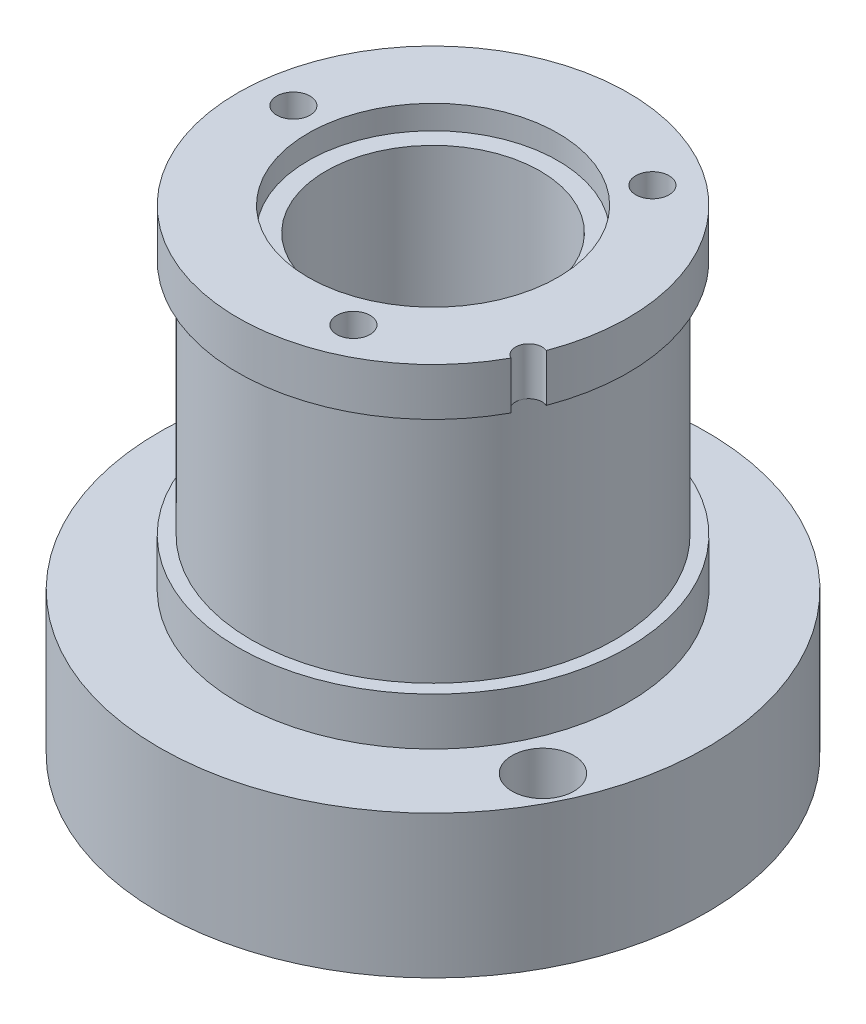
from build123d import *

# Parameters (mm, degrees)
SKETCH1_R                     = 14.605
BOSS_EXTRUDE2_DEPTH           = 25.4
SKETCH10_R                    = 5.715
CUT_EXTRUDE5_DEPTH            = 48.424233935
SKETCH11_R                    = 6.6675
CUT_EXTRUDE6_DEPTH            = 1.27
SKETCH12_OUTSIDE_W            = 40.908
SKETCH12_OUTSIDE_H            = 40.908
SKETCH12_OUTSIDE_R            = 10.414
CUT_EXTRUDE7_DEPTH            = 17.78
CIRPATTERN1_COUNT             = 3
CIRPATTERN2_COUNT             = 2
SKETCH26_R                    = 1.651
CUT_EXTRUDE8_DEPTH            = 8.89
CIRPATTERN3_COUNT             = 2
SKETCH27_R                    = 0.79375
CUT_EXTRUDE9_DEPTH            = 24.13
TAP_DRILL_FOR_0_80_TAP3_D     = 1.19126
TAP_DRILL_FOR_0_80_TAP3_DEPTH = 6.35
TAP_DRILL_FOR_0_80_TAP3_TIP   = 0.499792913
CUT_EXTRUDE10_START           = 15.24
SKETCH33_R                    = 10.414
SKETCH33_R_2                  = 9.7028
CUT_EXTRUDE10_DEPTH           = 15.24
BOSS_EXTRUDE3_START           = 2.54
SKETCH33_2_R                  = 10.414
SKETCH33_2_R_2                = 9.7028
BOSS_EXTRUDE3_DEPTH           = 2.54
SKETCH35_R                    = 0.7112
CUT_EXTRUDE11_DEPTH           = 3.556


with BuildPart() as part:
    # Sketch1 → Boss-Extrude2 (new body)
    with BuildSketch(Plane(origin=(0, 0, 0), x_dir=(1, 0, 0), z_dir=(0, 1, 0))):
        with Locations((13.028153923, -14.383045271)):
            Circle(SKETCH1_R)
    extrude(amount=BOSS_EXTRUDE2_DEPTH)

    # Sketch10 → Cut-Extrude5 (cut, through all)
    with BuildSketch(Plane(origin=(0, 25.4, 0), x_dir=(1, 0, 0), z_dir=(0, 1, 0))):
        with Locations((13.028153923, -14.383045271)):
            Circle(SKETCH10_R)
    extrude(amount=-CUT_EXTRUDE5_DEPTH, mode=Mode.SUBTRACT)

    # Sketch11 → Cut-Extrude6 (cut)
    with BuildSketch(Plane(origin=(0, 25.4, 0), x_dir=(1, 0, 0), z_dir=(0, 1, 0))):
        with Locations((13.028153923, -14.383045271)):
            Circle(SKETCH11_R)
    extrude(amount=-CUT_EXTRUDE6_DEPTH, mode=Mode.SUBTRACT)

    # Sketch12 outside → Cut-Extrude7 (cut)
    with BuildSketch(Plane(origin=(0, 25.4, 0), x_dir=(1, 0, 0), z_dir=(0, 1, 0))):
        with Locations((13.028, -14.383)):
            Rectangle(SKETCH12_OUTSIDE_W, SKETCH12_OUTSIDE_H)
        with Locations((13.028153923, -14.383045271)):
            Circle(SKETCH12_OUTSIDE_R, mode=Mode.SUBTRACT)
    extrude(amount=-CUT_EXTRUDE7_DEPTH, mode=Mode.SUBTRACT)

    # Sketch17 → #50 (0.07) Diameter Hole1 (revolve, cut)
    with BuildSketch(Plane(origin=(4.692367215, 25.4, 13.504077717), x_dir=(0, 0, 1), z_dir=(1, 0, 0))):
        Polygon((0, 0), (0, 3.07416509), (0.889, 2.54), (0.889, 0), align=None)
    f_50_0_07_diameter_hole1 = revolve(axis=Axis((4.692367215, 31.75, 13.504077717), (0, -1, 0)), mode=Mode.SUBTRACT)

    # CirPattern1: #50 (0.07) Diameter Hole1 ×3 about axis
    cirpattern1_axis = Axis((13.028153923, 7.62, 14.383045271), (0, 1, 0))
    for i in range(1, CIRPATTERN1_COUNT):
        add(f_50_0_07_diameter_hole1.rotate(cirpattern1_axis, i * 360 / CIRPATTERN1_COUNT), mode=Mode.SUBTRACT)

    # Sketch24 → 1/16 (0.0625) Diameter Hole2 (revolve, cut)
    with BuildSketch(Plane(origin=(8.163266455, 0, 24.388191195), x_dir=(0, 0, -1), z_dir=(1, 0, 0))):
        Polygon((0, 0), (0, 4.477433116), (0.79375, 4.0005), (0.79375, 0), align=None)
    f_1_16_0_0625_diameter_hole2 = revolve(axis=Axis((8.163266455, -6.35, 24.388191195), (0, 1, 0)), mode=Mode.SUBTRACT)

    # CirPattern2: 1/16 (0.0625) Diameter Hole2 ×2 about axis
    cirpattern2_axis = Axis((13.028153923, 25.4, 14.383045271), (0, -1, 0))
    for i in range(1, CIRPATTERN2_COUNT):
        add(f_1_16_0_0625_diameter_hole2.rotate(cirpattern2_axis, i * 360 / CIRPATTERN2_COUNT), mode=Mode.SUBTRACT)

    # Sketch26 → Cut-Extrude8 (cut)
    with BuildSketch(Plane(origin=(0, 0, 0), x_dir=(-1, 0, 0), z_dir=(0, -1, 0))):
        with Locations((-1.606754466, -8.829520764)):
            Circle(SKETCH26_R)
    cut_extrude8 = extrude(amount=-CUT_EXTRUDE8_DEPTH, mode=Mode.SUBTRACT)

    # CirPattern3: Cut-Extrude8 ×2 about axis
    cirpattern3_axis = Axis((13.028153923, 25.4, 14.383045271), (0, -1, 0))
    for i in range(1, CIRPATTERN3_COUNT):
        add(cut_extrude8.rotate(cirpattern3_axis, i * 360 / CIRPATTERN3_COUNT), mode=Mode.SUBTRACT)

    # Sketch27 → Cut-Extrude9 (cut)
    with BuildSketch(Plane(origin=(0, 0, 0), x_dir=(-1, 0, 0), z_dir=(0, -1, 0))):
        with Locations((-5.827402564, -17.142659866)):
            Circle(SKETCH27_R)
    extrude(amount=-CUT_EXTRUDE9_DEPTH, mode=Mode.SUBTRACT)

    # Tap Drill for #0-80 Tap3
    with Locations(Plane(origin=(0, 0, 0), x_dir=(-1, 0, 0), z_dir=(0, -1, 0))):
        with Locations((-5.827402564, -15.237659866), (-5.827402564, -19.047659866)):
            Hole(TAP_DRILL_FOR_0_80_TAP3_D / 2, depth=TAP_DRILL_FOR_0_80_TAP3_DEPTH)
            with Locations((0, 0, -(TAP_DRILL_FOR_0_80_TAP3_DEPTH + TAP_DRILL_FOR_0_80_TAP3_TIP / 2))):  # 100° drill point
                Cone(0, TAP_DRILL_FOR_0_80_TAP3_D / 2, TAP_DRILL_FOR_0_80_TAP3_TIP, mode=Mode.SUBTRACT)

    # Sketch33 → Cut-Extrude10 (cut)
    with BuildSketch(Plane(origin=(0, 7.62, 0), x_dir=(1, 0, 0), z_dir=(0, 1, 0)).offset(CUT_EXTRUDE10_START)):
        with Locations((13.028153923, -14.383045271)):
            Circle(SKETCH33_R)
        with Locations((13.028153923, -14.383045271)):
            Circle(SKETCH33_R_2, mode=Mode.SUBTRACT)
    extrude(amount=-CUT_EXTRUDE10_DEPTH, mode=Mode.SUBTRACT)

    # Sketch33<2> → Boss-Extrude3 (add)
    with BuildSketch(Plane(origin=(0, 7.62, 0), x_dir=(1, 0, 0), z_dir=(0, 1, 0)).offset(BOSS_EXTRUDE3_START)):
        with Locations((13.028153923, -14.383045271)):
            Circle(SKETCH33_2_R)
        with Locations((13.028153923, -14.383045271)):
            Circle(SKETCH33_2_R_2, mode=Mode.SUBTRACT)
    extrude(amount=-BOSS_EXTRUDE3_DEPTH)

    # Sketch35 → Cut-Extrude11 (cut)
    with BuildSketch(Plane(origin=(0, 25.4, 0), x_dir=(1, 0, 0), z_dir=(0, 1, 0))):
        with Locations((22.490332014, -18.732594877)):
            Circle(SKETCH35_R)
    extrude(amount=-CUT_EXTRUDE11_DEPTH, mode=Mode.SUBTRACT)


solid = part.part
